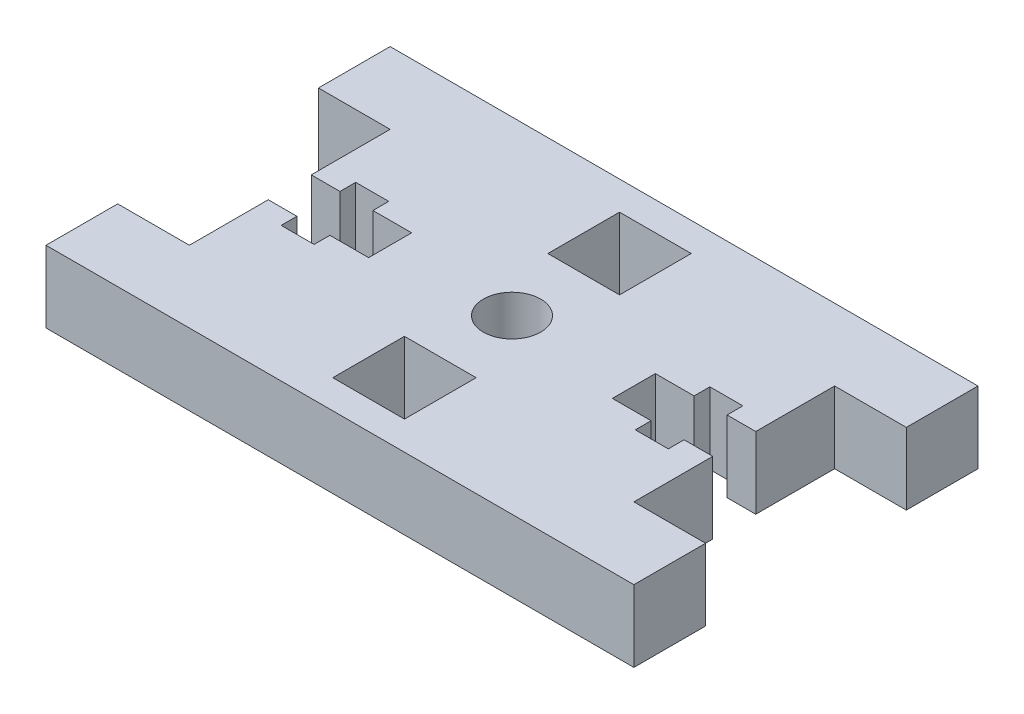
from build123d import *

# Parameters (mm, degrees)
BOSS_EXTRUDE1_DEPTH = 5
SKETCH2_R           = 2
SKETCH2_W           = 5
SKETCH2_H           = 5
CUT_EXTRUDE1_DEPTH  = 10


with BuildPart() as part:
    # Sketch1 → Boss-Extrude1 (new body)
    with BuildSketch(Plane(origin=(0, 0, 0), x_dir=(1, 0, 0), z_dir=(0, 1, 0))):
        Polygon((44.375484097, 7.788988346), (75.375484097, 7.788988346), (80.375484097, 7.788988346), (80.375484097, 12.788988346), (75.375484097, 12.788988346), (75.375484097, 18.288988346), (73.375484097, 18.288988346), (73.375484097, 17.188988346), (71.075484097, 17.188988346), (71.075484097, 18.288988346), (68.375484097, 18.288988346), (68.375484097, 21.288988346), (71.075484097, 21.288988346), (71.075484097, 22.388988346), (73.375484097, 22.388988346), (73.375484097, 21.288988346), (75.375484097, 21.288988346), (75.375484097, 26.788988346), (80.375484097, 26.788988346), (80.375484097, 31.788988346), (75.375484097, 31.788988346), (44.375484097, 31.788988346), (39.375484097, 31.788988346), (39.375484097, 26.788988346), (44.375484097, 26.788988346), (44.375484097, 21.288988346), (46.375484097, 21.288988346), (46.375484097, 22.388988346), (48.675484097, 22.388988346), (48.675484097, 21.288988346), (51.375484097, 21.288988346), (51.375484097, 18.288988346), (48.675484097, 18.288988346), (48.675484097, 17.188988346), (46.375484097, 17.188988346), (46.375484097, 18.288988346), (44.375484097, 18.288988346), (44.375484097, 12.788988346), (39.375484097, 12.788988346), (39.375484097, 7.788988346), align=None)
    extrude(amount=BOSS_EXTRUDE1_DEPTH)

    # Sketch2 → Cut-Extrude1 (cut)
    with BuildSketch(Plane(origin=(0, 5, 0), x_dir=(1, 0, 0), z_dir=(0, 1, 0))):
        with Locations(Location((59.875484097, 19.788988346, 0), (0, 0, 270))):
            Circle(SKETCH2_R)
        with Locations((59.875484097, 12.288988346)):
            Rectangle(SKETCH2_W, SKETCH2_H)
        with Locations((59.875484097, 27.288988346)):
            Rectangle(SKETCH2_W, SKETCH2_H)
    extrude(amount=-CUT_EXTRUDE1_DEPTH, mode=Mode.SUBTRACT)


solid = part.part
